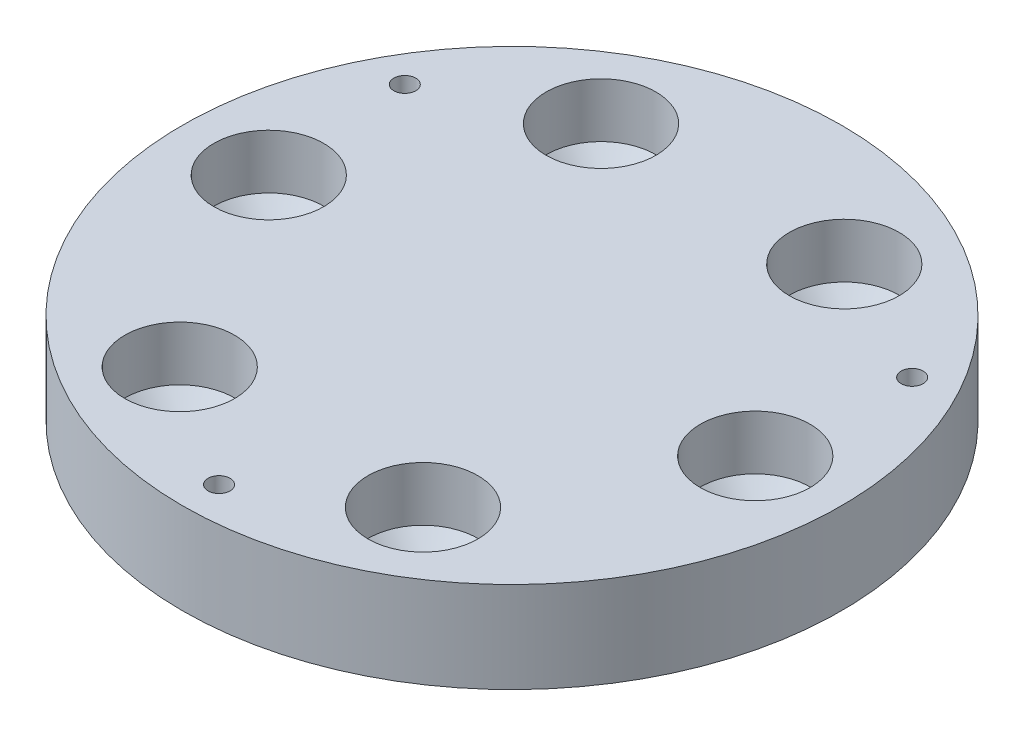
from build123d import *

# Parameters (mm, degrees)
BOSS_EXTRUDE1_DEPTH       = 10.425440853
BOSS_EXTRUDE1_DEPTH_BACK  = 2
SKETCH1_R                 = 45
F_8_0MM_DOWEL_HOLE1_D     = 15
F_8_0MM_DOWEL_HOLE1_DEPTH = 7.425440853
F_8_0MM_DOWEL_HOLE1_TIP   = 7.5
F_3_0_3_DIAMETER_HOLE1_D  = 3


with BuildPart() as part:
    # Sketch1 → Boss-Extrude1 (new, two sides: drawn at the far end of the back side and taken through both)
    with BuildSketch(Plane(origin=(0, 0, 0), x_dir=(1, 0, 0), z_dir=(0, 1, 0)).offset(-BOSS_EXTRUDE1_DEPTH_BACK)):
        with Locations(Location((0, 0, 0), (0, 0, 270))):
            Circle(SKETCH1_R)
    extrude(amount=BOSS_EXTRUDE1_DEPTH + BOSS_EXTRUDE1_DEPTH_BACK)

    # Ø8.0mm Dowel Hole1
    with Locations(Plane(origin=(0, 10.425440853, 0), x_dir=(1, 0, 0), z_dir=(0, 1, 0))):
        with Locations((-16.606971943, 28.764119165), (-16.606971943, -28.764119165), (33.213943886, 0), (16.606971943, 28.764119165), (16.606971943, -28.764119165), (-33.213943886, 0)):
            Hole(F_8_0MM_DOWEL_HOLE1_D / 2, depth=F_8_0MM_DOWEL_HOLE1_DEPTH)
            with Locations((0, 0, -(F_8_0MM_DOWEL_HOLE1_DEPTH + F_8_0MM_DOWEL_HOLE1_TIP / 2))):  # 90° drill point
                Cone(0, F_8_0MM_DOWEL_HOLE1_D / 2, F_8_0MM_DOWEL_HOLE1_TIP, mode=Mode.SUBTRACT)

    # Ø3.0 (3) Diameter Hole1 (through all)
    with Locations(Plane(origin=(0, 10.425440853, 0), x_dir=(1, 0, 0), z_dir=(0, 1, 0))):
        with Locations((-34.641016151, 20), (0, -40), (34.641016151, 20)):
            Hole(F_3_0_3_DIAMETER_HOLE1_D / 2)


solid = part.part
